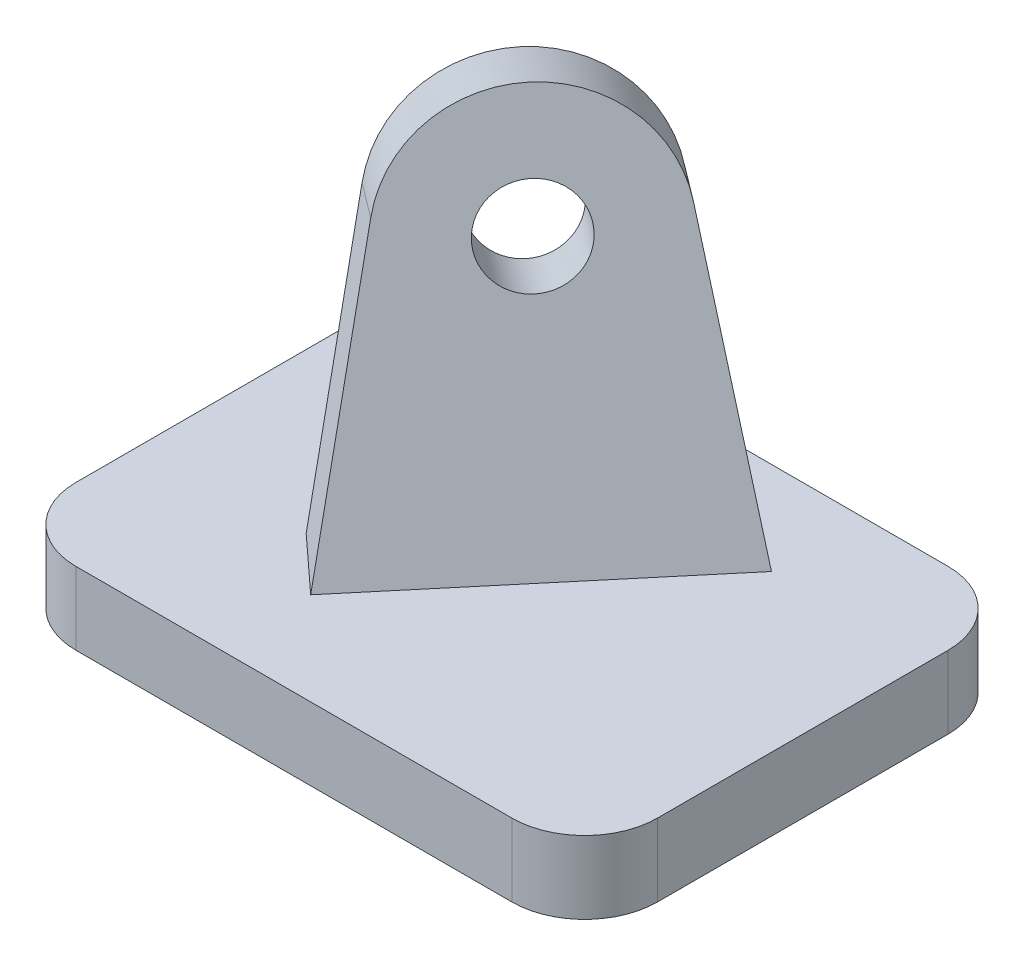
from build123d import *

# Parameters (mm, degrees)
EXTRUDE_1_DEPTH = 10
SKETCH_5_R      = 6
EXTRUDE_2_DEPTH = 10


with BuildPart() as part:
    # 草图1 → 凸台-拉伸1 (new body)
    with BuildSketch(Plane(origin=(0, 0, 0), x_dir=(1, 0, 0), z_dir=(0, 1, 0))):
        with BuildLine():
            Line((-30, 30), (30, 30))
            ThreePointArc((30, 30), (37.071067812, 27.071067812), (40, 20))
            Line((40, 20), (40, -20))
            ThreePointArc((40, -20), (37.071067812, -27.071067812), (30, -30))
            Line((30, -30), (-30, -30))
            ThreePointArc((-30, -30), (-37.071067812, -27.071067812), (-40, -20))
            Line((-40, -20), (-40, 20))
            ThreePointArc((-40, 20), (-37.071067812, 27.071067812), (-30, 30))
        make_face()
    extrude(amount=EXTRUDE_1_DEPTH)

    # 草图5 → 凸台-拉伸2 (add)
    with BuildSketch(Plane(origin=(4.105168422, 1.435917424, 3.444645309), x_dir=(0.6427876096865377, 0, -0.7660444431189795), z_dir=(0.73994211169385, 0.2588190451025179, 0.6208851530148445))):
        with BuildLine():
            Line((-19.928849561, 8.866190698), (25.071150439, 8.866190698))
            Line((25.071150439, 8.866190698), (18.334609469, 47.607241481))
            ThreePointArc((18.334609469, 47.607241481), (2.571150439, 60.866190698), (-13.192308592, 47.607241481))
            Line((-13.192308592, 47.607241481), (-19.928849561, 8.866190698))
        make_face()
        with Locations((2.571150439, 44.866190698)):
            Circle(SKETCH_5_R, mode=Mode.SUBTRACT)
    extrude(amount=-EXTRUDE_2_DEPTH)


solid = part.part
